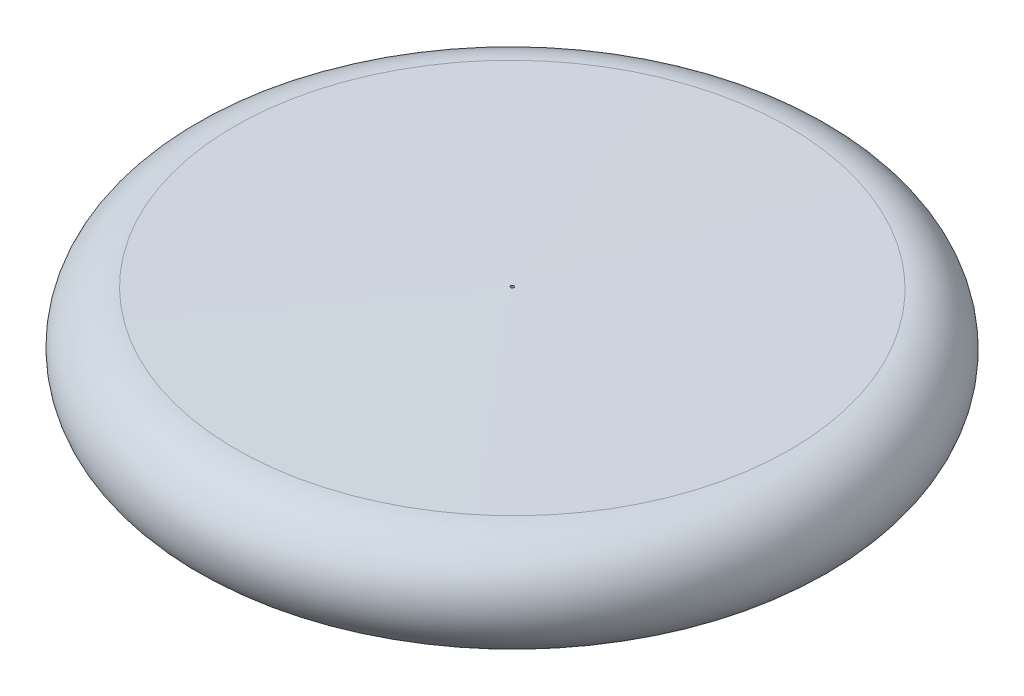
from build123d import *

# Parameters (mm, degrees)
SCALE1_SCALE = 0.5
SCALE2_SCALE = 0.3
SCALE3_SCALE = 0.5
SCALE5_SCALE = 5


with BuildPart() as part:
    # Sketch1 → Revolve1 (revolve)
    with BuildSketch(Plane.XY, mode=Mode.PRIVATE) as revolve1_sk:
        with BuildLine():
            Line((-2.258036414, 14.369211187), (30.108325784, 14.369211187))
            Line((30.108325784, 14.369211187), (30.108325784, 2.156708547))
            Line((30.108325784, 2.156708547), (-2.258036414, 2.156708547))
            ThreePointArc((-2.258036414, 2.156708547), (-8.364287734, 8.262959867), (-2.258036414, 14.369211187))
        make_face()
    revolve(revolve1_sk.sketch.rotate(Axis((30.290952568, 14.369211187, 0), (-0.004261675171453159, -0.9999909190211345, 0)), 180), axis=Axis((30.290952568, 14.369211187, 0), (-0.004261675171453159, -0.9999909190211345, 0)))


with BuildPart() as part_1:
    # Scale1: scaled about (30.264488075, 8.159387293, 0)
    add(part.part.scale(SCALE1_SCALE).moved(Location((15.132244037, 4.079693646, 0))))


with BuildPart() as part_2:
    # Scale2: scaled about (30.264488075, 8.159387293, 0)
    add(part_1.part.scale(SCALE2_SCALE).moved(Location((21.185141652, 5.711571105, 0))))


with BuildPart() as part_3:
    # Scale3: scaled about (30.264488075, 8.159387293, 0)
    add(part_2.part.scale(SCALE3_SCALE).moved(Location((15.132244037, 4.079693646, 0))))


with BuildPart() as part_4:
    # Scale5: scaled about (30.264488075, 8.159387293, 0)
    add(part_3.part.scale(SCALE5_SCALE).moved(Location((-121.0579523, -32.637549172, 0))))


solid = part_4.part
